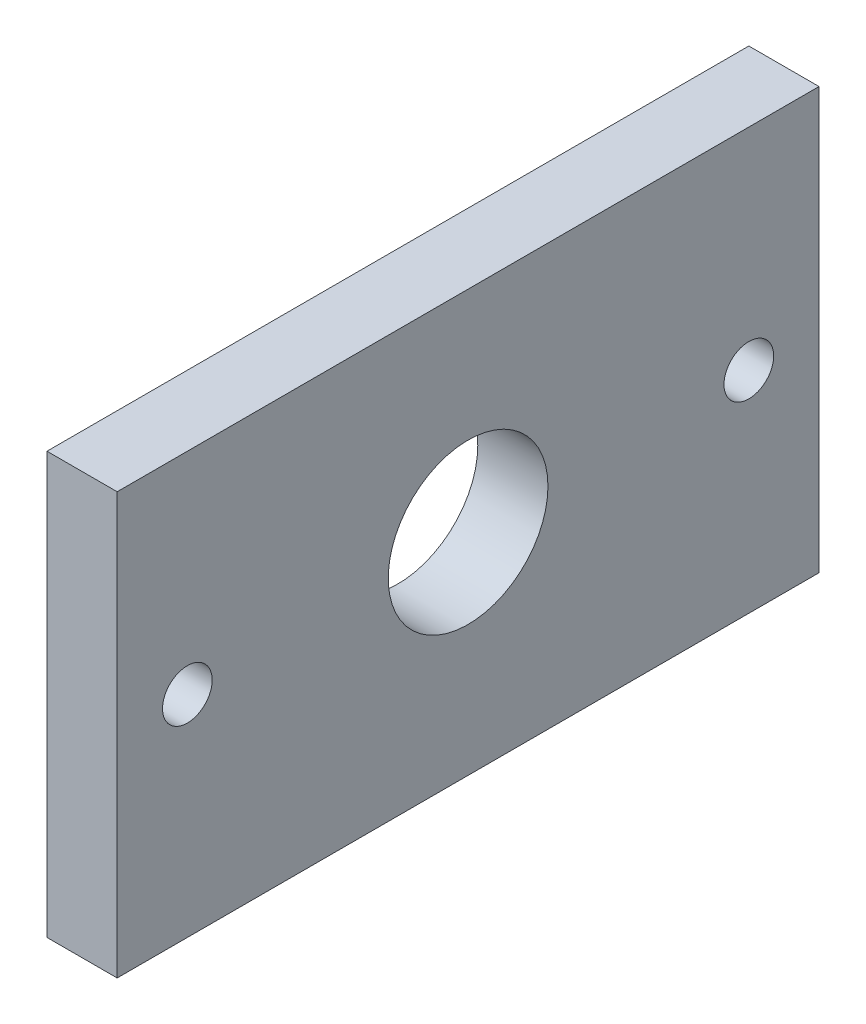
from build123d import *

# Parameters (mm, degrees)
SKETCH1_W           = 63.5
SKETCH1_H           = 38.1
SKETCH1_R           = 7.2263
SKETCH1_R_2         = 2.2479
BOSS_EXTRUDE1_DEPTH = 6.35


with BuildPart() as part:
    # Sketch1 → Boss-Extrude1 (new body)
    with BuildSketch(Plane(origin=(0, 0, 0), x_dir=(0, 0, -1), z_dir=(1, 0, 0))):
        Rectangle(SKETCH1_W, SKETCH1_H)
        Circle(SKETCH1_R, mode=Mode.SUBTRACT)
        with Locations((-25.4, 0)):
            Circle(SKETCH1_R_2, mode=Mode.SUBTRACT)
        with Locations(Location((25.4, 0, 0), (0, 0, 180))):
            Circle(SKETCH1_R_2, mode=Mode.SUBTRACT)
    extrude(amount=BOSS_EXTRUDE1_DEPTH)


solid = part.part
